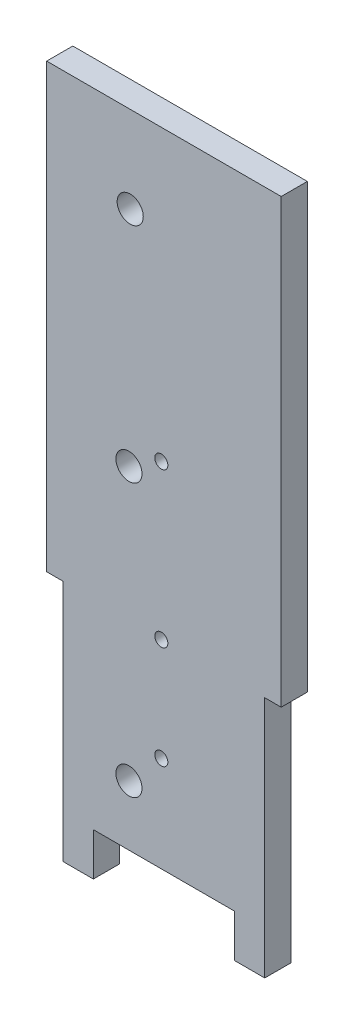
from build123d import *

# Parameters (mm, degrees)
BOSS_EXTRUDE1_DEPTH = 63.5
SKETCH2_W           = 343
SKETCH2_H           = 104
CUT_EXTRUDE1_DEPTH  = 1691.408900237
SKETCH3_R           = 31.75
CUT_EXTRUDE2_DEPTH  = 1691.408900237
SKETCH4_R           = 31.75
CUT_EXTRUDE3_DEPTH  = 1691.408900237
SKETCH5_R           = 15.875
CUT_EXTRUDE4_DEPTH  = 1691.408900237


with BuildPart() as part:
    # Sketch1 → Boss-Extrude1 (new body)
    with BuildSketch(Plane.XY):
        Polygon((-245, 0), (245, 0), (245, 590), (285, 590), (285, 1665), (-285, 1665), (-285, 590), (-245, 590), align=None)
    extrude(amount=BOSS_EXTRUDE1_DEPTH)

    # Sketch2 → Cut-Extrude1 (cut, through all)
    with BuildSketch(Plane(origin=(0, 0, 0), x_dir=(-1, 0, 0), z_dir=(0, 0, -1))):
        with Locations((0, 52)):
            Rectangle(SKETCH2_W, SKETCH2_H)
    extrude(amount=-CUT_EXTRUDE1_DEPTH, mode=Mode.SUBTRACT)

    # Sketch3 → Cut-Extrude2 (cut, through all)
    with BuildSketch(Plane.XY.offset(63.5)):
        with Locations((-82, 1455)):
            Circle(SKETCH3_R)
    extrude(amount=-CUT_EXTRUDE2_DEPTH, mode=Mode.SUBTRACT)

    # Sketch4 → Cut-Extrude3 (cut, through all)
    with BuildSketch(Plane.XY.offset(63.5)):
        with Locations((-85, 250)):
            Circle(SKETCH4_R)
        with Locations((-85, 911.9875)):
            Circle(SKETCH4_R)
    extrude(amount=-CUT_EXTRUDE3_DEPTH, mode=Mode.SUBTRACT)

    # Sketch5 → Cut-Extrude4 (cut, through all)
    with BuildSketch(Plane.XY.offset(63.5)):
        with Locations((-6.4, 336.5)):
            Circle(SKETCH5_R)
        with Locations((-6.4, 586.5)):
            Circle(SKETCH5_R)
        with Locations((-6.4, 961.5)):
            Circle(SKETCH5_R)
    extrude(amount=-CUT_EXTRUDE4_DEPTH, mode=Mode.SUBTRACT)


solid = part.part
